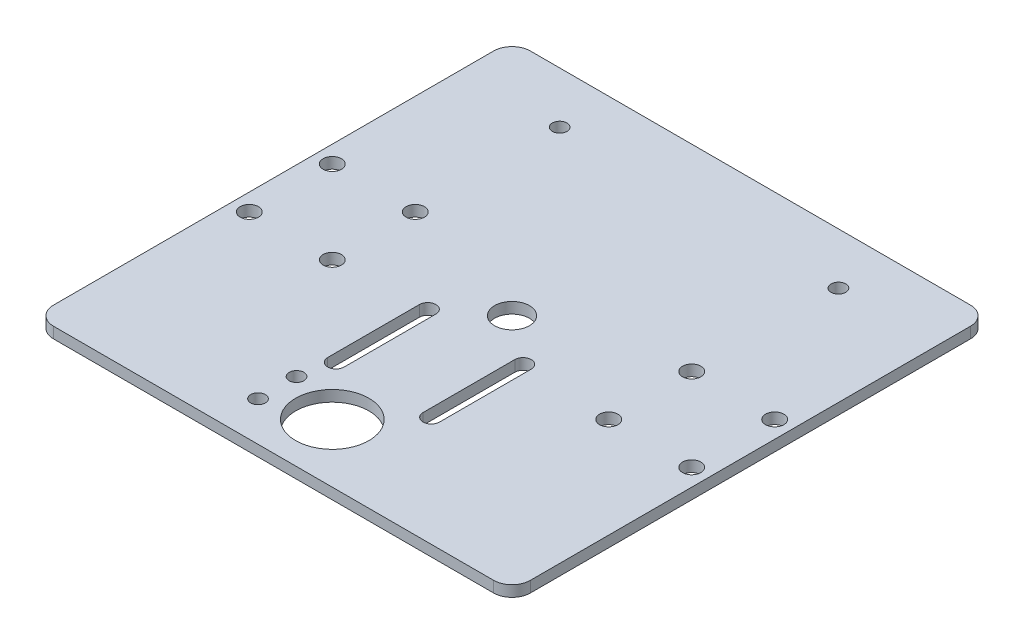
from build123d import *

# Parameters (mm, degrees)
SKETCH1_W                = 130
SKETCH1_H                = 130
BOSS_EXTRUDE1_DEPTH      = 3
FILLET1_R                = 5
SKETCH2_R                = 4.75
CUT_EXTRUDE1_DEPTH       = 92.972822073
F_5_0_5_DIAMETER_HOLE1_D = 5
F_4_0_4_DIAMETER_HOLE1_D = 4
SKETCH8_R                = 10
CUT_EXTRUDE2_DEPTH       = 92.972822073
F_4_0_4_DIAMETER_HOLE2_D = 4


with BuildPart() as part:
    # Sketch1 → Boss-Extrude1 (new body)
    with BuildSketch(Plane(origin=(0, 0, 0), x_dir=(1, 0, 0), z_dir=(0, 1, 0))):
        Rectangle(SKETCH1_W, SKETCH1_H)
    extrude(amount=BOSS_EXTRUDE1_DEPTH)

    # Fillet1
    fillet1_edges = [part.edges().sort_by_distance(p)[0] for p in [
        (65, 1.5, 65),
        (-65, 1.5, 65),
        (-65, 1.5, -65),
        (65, 1.5, -65),
    ]]
    fillet(fillet1_edges, radius=FILLET1_R)

    # Sketch2 → Cut-Extrude1 (cut, through all)
    with BuildSketch(Plane(origin=(0, 0, 0), x_dir=(1, 0, 0), z_dir=(0, 1, 0))):
        with Locations(Location((0, 0, 0), (0, 0, 270))):
            Circle(SKETCH2_R)
    extrude(amount=CUT_EXTRUDE1_DEPTH, mode=Mode.SUBTRACT)

    # Ø5.0 (5) Diameter Hole1 (through all)
    with Locations(Plane(origin=(0, 0, 0), x_dir=(-1, 0, 0), z_dir=(0, -1, 0))):
        with Locations((60.313708499, 11.313708499), (60.313708499, -11.313708499), (37.686291501, -11.313708499), (37.686291501, 11.313708499)):
            f_5_0_5_diameter_hole1 = Hole(F_5_0_5_DIAMETER_HOLE1_D / 2)

    # Mirror1: Ø5.0 (5) Diameter Hole1 across plane
    add(f_5_0_5_diameter_hole1.mirror(Plane(origin=(0, 0, 0), x_dir=(0, 0, 1), z_dir=(1, 0, 0))), mode=Mode.SUBTRACT)

    # Ø4.0 (4) Diameter Hole1 (through all)
    with Locations(Plane(origin=(0, 3, 0), x_dir=(1, 0, 0), z_dir=(0, 1, 0))):
        with Locations((38, 51), (-38, 51)):
            Hole(F_4_0_4_DIAMETER_HOLE1_D / 2)

    # Sketch8 → Cut-Extrude2 (cut, through all)
    with BuildSketch(Plane(origin=(0, 0, 0), x_dir=(1, 0, 0), z_dir=(0, 1, 0))):
        with Locations(Location((0, -49, 0), (0, 0, 270))):
            Circle(SKETCH8_R)
        with BuildLine():
            Line((10.75, -35), (10.75, -10))
            ThreePointArc((10.75, -10), (13, -7.75), (15.25, -10))
            Line((15.25, -10), (15.25, -35))
            ThreePointArc((15.25, -35), (13, -37.25), (10.75, -35))
        make_face()
        with BuildLine():
            Line((-10.75, -35), (-10.75, -10))
            ThreePointArc((-10.75, -10), (-13, -7.75), (-15.25, -10))
            Line((-15.25, -10), (-15.25, -35))
            ThreePointArc((-15.25, -35), (-13, -37.25), (-10.75, -35))
        make_face()
    extrude(amount=CUT_EXTRUDE2_DEPTH, mode=Mode.SUBTRACT)

    # Ø4.0 (4) Diameter Hole2 (through all)
    with Locations(Plane(origin=(0, 3, 0), x_dir=(1, 0, 0), z_dir=(0, 1, 0))):
        with Locations((-15, -54.25), (-15, -43.75)):
            Hole(F_4_0_4_DIAMETER_HOLE2_D / 2)


solid = part.part
